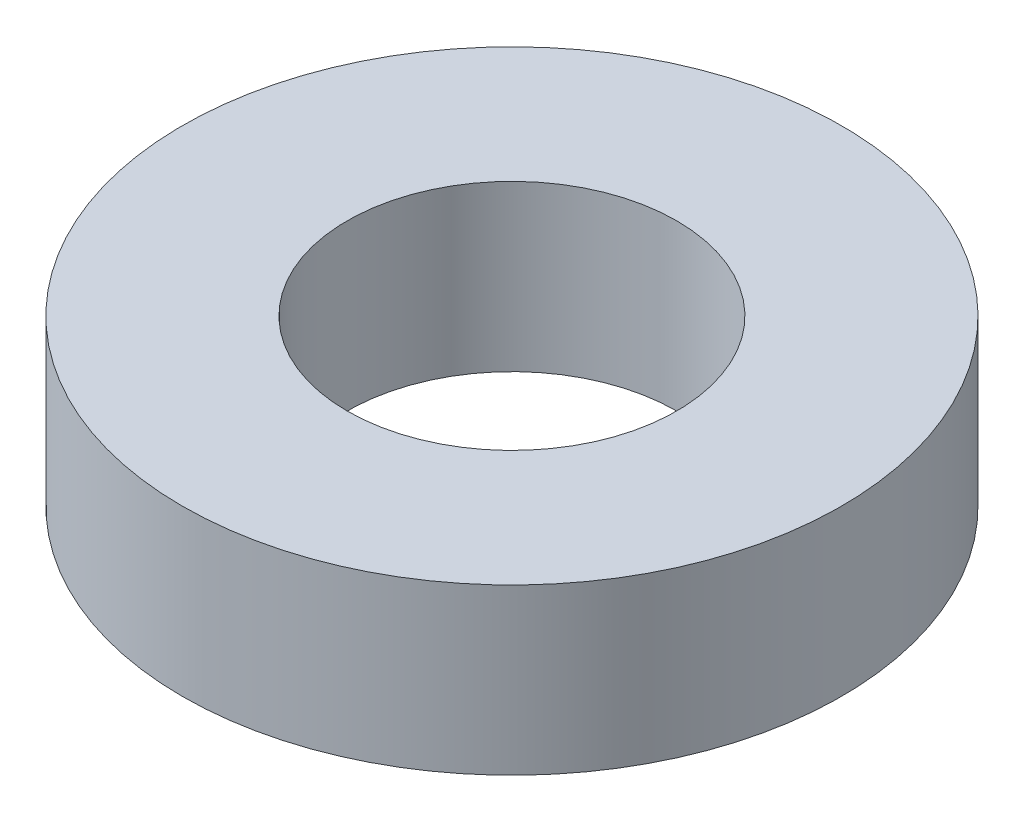
from build123d import *

# Parameters (mm, degrees)
SKETCH1_R           = 6.35
SKETCH1_R_2         = 3.175
BOSS_EXTRUDE1_DEPTH = 3.175


with BuildPart() as part:
    # Sketch1 → Boss-Extrude1 (new body)
    with BuildSketch(Plane(origin=(0, 0, 0), x_dir=(1, 0, 0), z_dir=(0, 1, 0))):
        with Locations(Location((0, 0, 0), (0, 0, 270))):
            Circle(SKETCH1_R)
        with Locations(Location((0, 0, 0), (0, 0, 270))):
            Circle(SKETCH1_R_2, mode=Mode.SUBTRACT)
    extrude(amount=BOSS_EXTRUDE1_DEPTH)


solid = part.part
